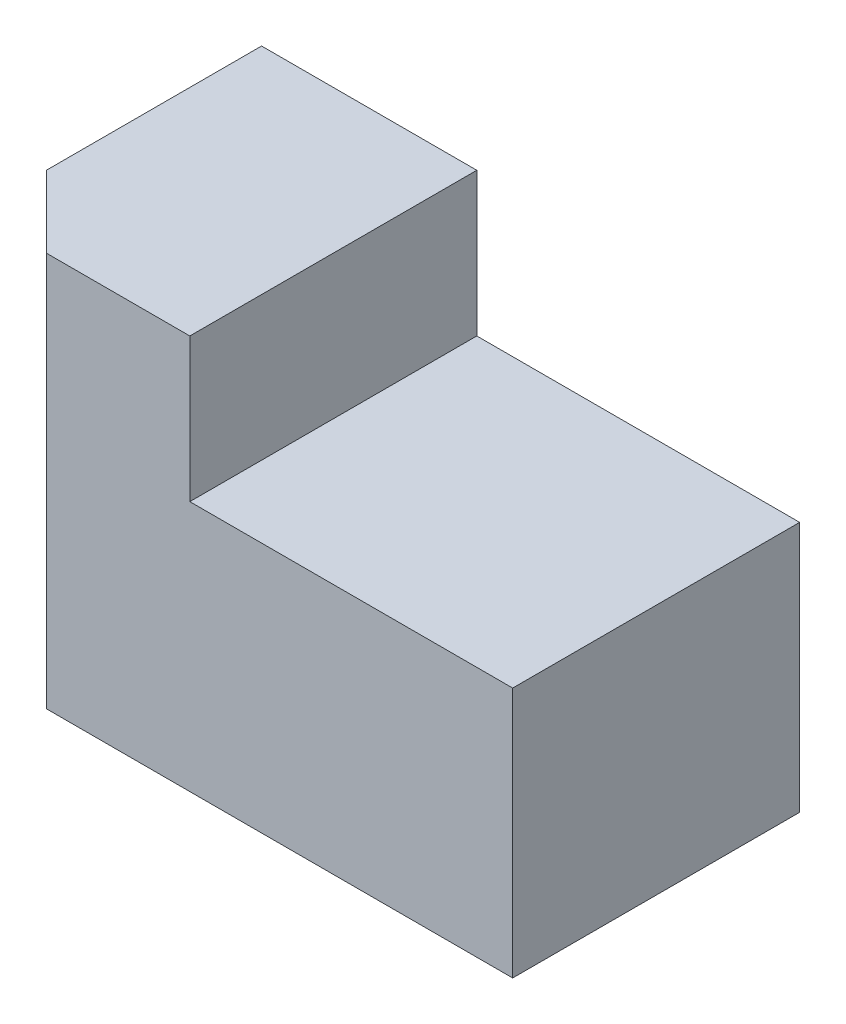
from build123d import *

# Parameters (mm, degrees)
BOSS_EXTRUDE1_DEPTH = 69.85
SKETCH2_W           = 50.8
SKETCH2_H           = 44.45
BOSS_EXTRUDE2_DEPTH = 57.15
SKETCH3_W           = 6.35
SKETCH3_H           = 38.1
BOSS_EXTRUDE3_DEPTH = 6.35


with BuildPart() as part:
    # Sketch1 → Boss-Extrude1 (new body)
    with BuildSketch(Plane(origin=(0, 0, 0), x_dir=(1, 0, 0), z_dir=(0, 1, 0))):
        Polygon((0, 0), (0, 38.1), (38.1, 38.1), (38.1, -12.7), (12.7, -12.7), align=None)
    extrude(amount=BOSS_EXTRUDE1_DEPTH)

    # Sketch2 → Boss-Extrude2 (add)
    with BuildSketch(Plane(origin=(38.1, 0, 0), x_dir=(0, 0, -1), z_dir=(1, 0, 0))):
        with Locations((12.7, 22.225)):
            Rectangle(SKETCH2_W, SKETCH2_H)
    extrude(amount=BOSS_EXTRUDE2_DEPTH)

    # Sketch3 → Boss-Extrude3 (add)
    with BuildSketch(Plane(origin=(0, 0, 0), x_dir=(-1, 0, 0), z_dir=(0, -1, 0))):
        with Locations((-53.975, 12.7)):
            Rectangle(SKETCH3_W, SKETCH3_H)
        with Locations((-28.575, 12.7)):
            Rectangle(SKETCH3_W, SKETCH3_H)
        with Locations((-41.275, 12.7)):
            Rectangle(SKETCH3_W, SKETCH3_H)
        with Locations((-66.675, 12.7)):
            Rectangle(SKETCH3_W, SKETCH3_H)
        with Locations((-79.375, 12.7)):
            Rectangle(SKETCH3_W, SKETCH3_H)
    extrude(amount=BOSS_EXTRUDE3_DEPTH)


solid = part.part
